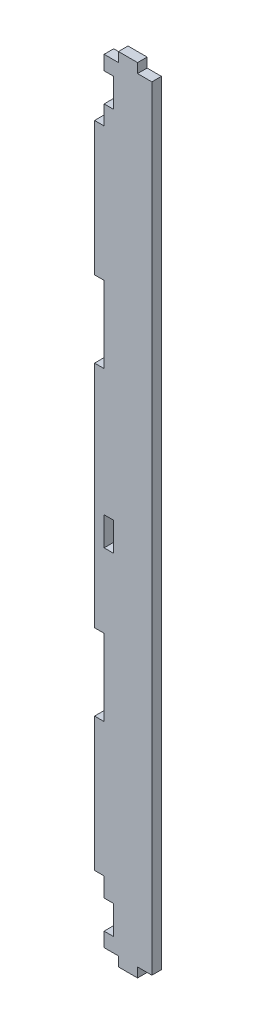
from build123d import *

# Parameters (mm, degrees)
SKETCH1_W           = 5
SKETCH1_H           = 15
BOSS_EXTRUDE1_DEPTH = 5


with BuildPart() as part:
    # Sketch1 → Boss-Extrude1 (new body)
    with BuildSketch(Plane.XY):
        Polygon((-440, -217.5), (-440, -177.5), (-445, -177.5), (-445, -107.5), (-440, -107.5), (-440, -97.5), (-435, -97.5), (-435, -82.5), (-440, -82.5), (-440, -75), (-432.5, -75), (-432.5, -70), (-422.5, -70), (-422.5, -75), (-415, -75), (-415, -480), (-422.5, -480), (-422.5, -485), (-432.5, -485), (-432.5, -480), (-440, -480), (-440, -472.5), (-435, -472.5), (-435, -457.5), (-440, -457.5), (-440, -447.5), (-445, -447.5), (-445, -377.5), (-440, -377.5), (-440, -337.5), (-445, -337.5), (-445, -217.5), align=None)
        with Locations((-437.5, -291.25)):
            Rectangle(SKETCH1_W, SKETCH1_H, mode=Mode.SUBTRACT)
    extrude(amount=BOSS_EXTRUDE1_DEPTH)


solid = part.part
